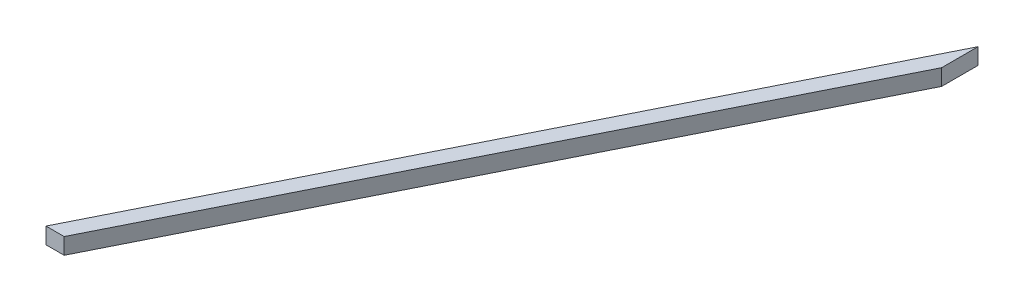
from build123d import *

# Parameters (mm, degrees)
BOSS_EXTRUDE1_DEPTH = 25.4


with BuildPart() as part:
    # Sketch1 → Boss-Extrude1 (new body)
    with BuildSketch(Plane(origin=(0, 0, 0), x_dir=(1, 0, 0), z_dir=(0, 1, 0))):
        Polygon((-587.415189873, -83.916455696), (-130.215189873, 830.483544304), (-130.215189873, 887.279670932), (-152.933640525, 841.842769629), (-610.133640525, -72.557230371), (-615.813253188, -83.916455696), align=None)
    extrude(amount=BOSS_EXTRUDE1_DEPTH)


solid = part.part
